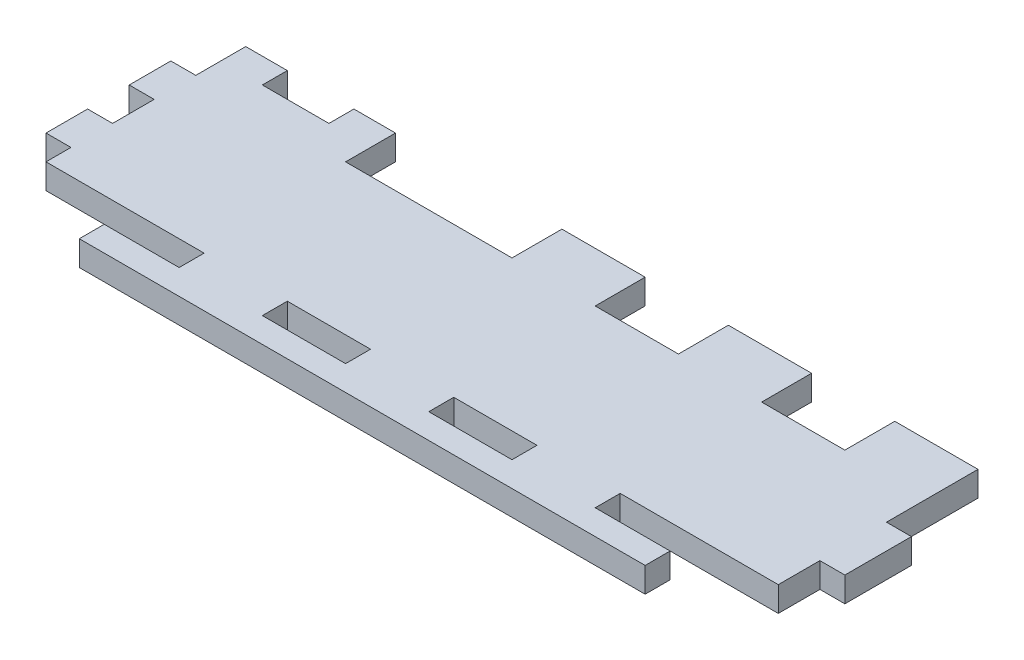
from build123d import *

# Parameters (mm, degrees)
SKETCH1_W           = 88
SKETCH1_H           = 18
BOSS_EXTRUDE1_DEPTH = 3
SKETCH2_W           = 18
SKETCH2_H           = 3
BOSS_EXTRUDE2_DEPTH = 3
SKETCH3_W           = 10
SKETCH3_H           = 3
BOSS_EXTRUDE3_DEPTH = 3
LPATTERN1_COUNT     = 3
LPATTERN1_PITCH     = 20
LPATTERN1_COL_COUNT = 3
LPATTERN1_COL_PITCH = 20
SKETCH4_W           = 1
SKETCH4_H           = 3
CUT_EXTRUDE1_DEPTH  = 92.493169144
SKETCH5_W           = 88
SKETCH5_H           = 3
BOSS_EXTRUDE4_DEPTH = 3
SKETCH6_W           = 5
SKETCH6_H           = 3
BOSS_EXTRUDE5_DEPTH = 3
SKETCH7_W           = 10
SKETCH7_H           = 6
BOSS_EXTRUDE6_DEPTH = 3
LPATTERN2_COUNT     = 3
LPATTERN2_PITCH     = 20
SKETCH9_W           = 9
SKETCH9_H           = 3
CUT_EXTRUDE2_DEPTH  = 92.263355187
SKETCH10_W          = 3
SKETCH10_H          = 5
SKETCH10_H_2        = 8
BOSS_EXTRUDE8_DEPTH = 3
SKETCH11_W          = 10
SKETCH11_H          = 3
CUT_EXTRUDE3_DEPTH  = 95.159439251


with BuildPart() as part:
    # Sketch1 → Boss-Extrude1 (new body)
    with BuildSketch(Plane(origin=(0, 0, 0), x_dir=(1, 0, 0), z_dir=(0, 1, 0))):
        with Locations((44, -9)):
            Rectangle(SKETCH1_W, SKETCH1_H)
    extrude(amount=BOSS_EXTRUDE1_DEPTH)

    # Sketch2 → Boss-Extrude2 (add, through all)
    with BuildSketch(Plane.XZ):
        with Locations((9, -1.5)):
            Rectangle(SKETCH2_W, SKETCH2_H)
    extrude(amount=-BOSS_EXTRUDE2_DEPTH)

    # Sketch3 → Boss-Extrude3 (add, through all)
    with BuildSketch(Plane.XZ):
        with Locations((44, 19.5)):
            Rectangle(SKETCH3_W, SKETCH3_H)
    boss_extrude3 = extrude(amount=-BOSS_EXTRUDE3_DEPTH)

    # LPattern1: Boss-Extrude3 ×3
    with Locations(*[(i * LPATTERN1_PITCH, 0, 0) for i in range(1, LPATTERN1_COUNT)]):
        add(boss_extrude3)

    # LPattern1 col: Boss-Extrude3 ×3
    with Locations(*[(-i * LPATTERN1_COL_PITCH, 0, 0) for i in range(1, LPATTERN1_COL_COUNT)]):
        add(boss_extrude3)

    # Sketch4 → Cut-Extrude1 (cut, through all)
    with BuildSketch(Plane(origin=(0, 0, 0), x_dir=(-1, 0, 0), z_dir=(0, -1, 0))):
        with Locations((0.5, -19.5)):
            Rectangle(SKETCH4_W, SKETCH4_H)
        with Locations((-88.5, -19.5)):
            Rectangle(SKETCH4_W, SKETCH4_H)
    extrude(amount=-CUT_EXTRUDE1_DEPTH, mode=Mode.SUBTRACT)

    # Sketch5 → Boss-Extrude4 (add, through all)
    with BuildSketch(Plane(origin=(0, 0, 0), x_dir=(-1, 0, 0), z_dir=(0, -1, 0))):
        with Locations((-44, -22.5)):
            Rectangle(SKETCH5_W, SKETCH5_H)
    extrude(amount=-BOSS_EXTRUDE4_DEPTH)

    # Sketch6 → Boss-Extrude5 (add, through all)
    with BuildSketch(Plane(origin=(0, 0, 0), x_dir=(-1, 0, 0), z_dir=(0, -1, 0))):
        with Locations((-2.5, 4.5)):
            Rectangle(SKETCH6_W, SKETCH6_H)
        with Locations((-15.5, 4.5)):
            Rectangle(SKETCH6_W, SKETCH6_H)
    extrude(amount=-BOSS_EXTRUDE5_DEPTH)

    # Sketch7 → Boss-Extrude6 (add, through all)
    with BuildSketch(Plane(origin=(0, 0, 0), x_dir=(-1, 0, 0), z_dir=(0, -1, 0))):
        with Locations((-83, 3)):
            Rectangle(SKETCH7_W, SKETCH7_H)
    boss_extrude6 = extrude(amount=-BOSS_EXTRUDE6_DEPTH)

    # LPattern2: Boss-Extrude6 ×3
    with Locations(*[(-i * LPATTERN2_PITCH, 0, 0) for i in range(1, LPATTERN2_COUNT)]):
        add(boss_extrude6)

    # Sketch9 → Cut-Extrude2 (cut, through all)
    with BuildSketch(Plane(origin=(0, 0, 0), x_dir=(-1, 0, 0), z_dir=(0, -1, 0))):
        with Locations((-4.5, -19.5)):
            Rectangle(SKETCH9_W, SKETCH9_H)
        with Locations((-83.5, -19.5)):
            Rectangle(SKETCH9_W, SKETCH9_H)
    extrude(amount=-CUT_EXTRUDE2_DEPTH, mode=Mode.SUBTRACT)

    # Sketch10 → Boss-Extrude8 (add, through all)
    with BuildSketch(Plane(origin=(0, 0, 0), x_dir=(-1, 0, 0), z_dir=(0, -1, 0))):
        with Locations((1.5, -12.5)):
            Rectangle(SKETCH10_W, SKETCH10_H)
        with Locations((-89.5, -9)):
            Rectangle(SKETCH10_W, SKETCH10_H_2)
        with Locations((1.5, -2.5)):
            Rectangle(SKETCH10_W, SKETCH10_H)
    extrude(amount=-BOSS_EXTRUDE8_DEPTH)

    # Sketch11 → Cut-Extrude3 (cut, through all)
    with BuildSketch(Plane(origin=(0, 0, 0), x_dir=(-1, 0, 0), z_dir=(0, -1, 0))):
        with Locations((-5, -22.5)):
            Rectangle(SKETCH11_W, SKETCH11_H)
        with Locations((-83, -22.5)):
            Rectangle(SKETCH11_W, SKETCH11_H)
    extrude(amount=-CUT_EXTRUDE3_DEPTH, mode=Mode.SUBTRACT)


solid = part.part
